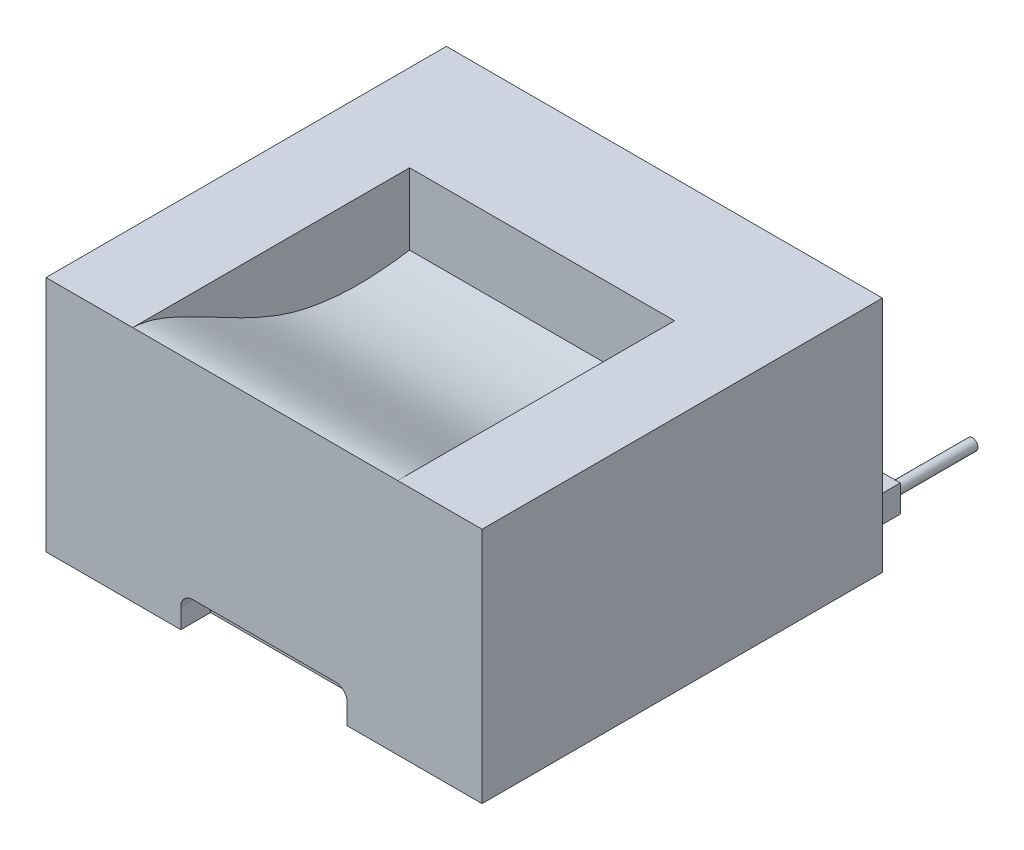
from build123d import *

# Parameters (mm, degrees)
SKETCH_1_W          = 367
SKETCH_1_H          = 337
EXTRUDE_1_DEPTH     = 200
SKETCH_2_W          = 245
SKETCH_2_H          = 47
EXTRUDE_2_DEPTH     = 47
SKETCH_3_W          = 18.503948035
SKETCH_3_H          = 22.759447516
EXTRUDE_3_DEPTH     = 35
SKETCH_4_R          = 4.689122638
EXTRUDE_4_DEPTH     = 70
CUT_EXTRUDE_1_DEPTH = 25
CUT_EXTRUDE_2_DEPTH = 223


with BuildPart() as part:
    # Эскиз1 → Бобышка-Вытянуть1 (new body)
    with BuildSketch(Plane(origin=(0, 0, 0), x_dir=(1, 0, 0), z_dir=(0, 1, 0))):
        with Locations((-16.254231815, -121.394753304)):
            Rectangle(SKETCH_1_W, SKETCH_1_H)
    extrude(amount=EXTRUDE_1_DEPTH)

    # Эскиз2 → Бобышка-Вытянуть2 (add)
    with BuildSketch(Plane(origin=(0, 0, -47.105246696), x_dir=(-1, 0, 0), z_dir=(0, 0, -1))):
        with Locations((16.254231815, 23.5)):
            Rectangle(SKETCH_2_W, SKETCH_2_H)
    extrude(amount=EXTRUDE_2_DEPTH)

    # Эскиз3 → Бобышка-Вытянуть3 (add)
    with BuildSketch(Plane(origin=(0, 0, -47.105246696), x_dir=(-1, 0, 0), z_dir=(0, 0, -1))):
        with Locations((-137.993794167, 26.379723758)):
            Rectangle(SKETCH_3_W, SKETCH_3_H)
    extrude(amount=EXTRUDE_3_DEPTH)

    # Эскиз4 → Бобышка-Вытянуть4 (add)
    with BuildSketch(Plane(origin=(0, 0, -82.105246696), x_dir=(-1, 0, 0), z_dir=(0, 0, -1))):
        with Locations((-137.993794168, 26.379723758)):
            Circle(SKETCH_4_R)
    extrude(amount=EXTRUDE_4_DEPTH)

    # Эскиз5 → Вырез-Вытянуть1 (cut)
    with BuildSketch(Plane.XY.offset(289.894753304)):
        with BuildLine():
            Line((-86.254231815, 0), (53.745768185, 0))
            Line((53.745768185, 0), (53.745768185, 17))
            ThreePointArc((53.745768185, 17), (50.816835997, 24.071067812), (43.745768185, 27))
            Line((43.745768185, 27), (-76.254231815, 27))
            ThreePointArc((-76.254231815, 27), (-83.325299626, 24.071067812), (-86.254231815, 17))
            Line((-86.254231815, 17), (-86.254231815, 0))
        make_face()
    extrude(amount=-CUT_EXTRUDE_1_DEPTH, mode=Mode.SUBTRACT)

    # Эскиз6 → Вырез-Вытянуть2 (cut)
    with BuildSketch(Plane(origin=(96.245768185, 0, 0), x_dir=(0, 0, -1), z_dir=(1, 0, 0))):
        with BuildLine():
            Line((-289.894753304, 200), (-56.894753304, 200))
            Line((-56.894753304, 200), (-56.894753304, 140))
            add(Edge.make_bspline(
                [(-289.894753304, 200), (-255.905913973, 199.483070544), (-195.675702754, 150.542684271), (-111.630124679, 134.680175733), (-84.590503935, 135.886366382), (-56.894753304, 140)],
                knots=[0, 0, 0, 0, 0.585078831, 0.685078831, 1, 1, 1, 1], degree=3))
        make_face()
    extrude(amount=-CUT_EXTRUDE_2_DEPTH, mode=Mode.SUBTRACT)


solid = part.part
